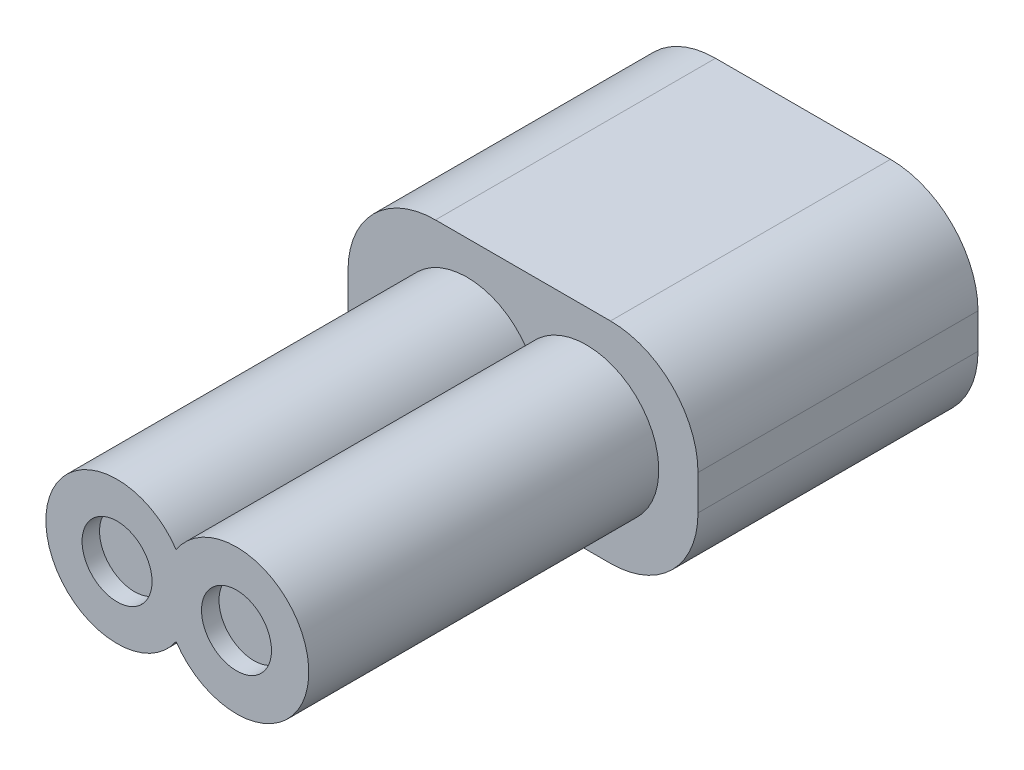
from build123d import *

# Parameters (mm, degrees)
EXTRUDE_1_DEPTH     = 16
EXTRUDE_3_DEPTH     = 20
SKETCH_4_R          = 2
CUT_EXTRUDE_1_DEPTH = 1


with BuildPart() as part:
    # ｽｹｯﾁ1 → ﾎﾞｽ - 押し出し1 (new body)
    with BuildSketch(Plane.XY):
        with BuildLine():
            Line((5, 0), (15, 0))
            ThreePointArc((15, 0), (18.535533906, 1.464466094), (20, 5))
            Line((20, 5), (20, 7))
            ThreePointArc((20, 7), (18.535533906, 10.535533906), (15, 12))
            Line((15, 12), (5, 12))
            ThreePointArc((5, 12), (1.464466094, 10.535533906), (0, 7))
            Line((0, 7), (0, 5))
            ThreePointArc((0, 5), (1.464466094, 1.464466094), (5, 0))
        make_face()
    extrude(amount=EXTRUDE_1_DEPTH)

    # ｽｹｯﾁ3 → ﾎﾞｽ - 押し出し3 (add)
    with BuildSketch(Plane.XY.offset(16)):
        with BuildLine():
            ThreePointArc((10.178530878, 3.727869439), (17.760027495, 6), (10.178530878, 8.272130561))
            ThreePointArc((10.178530878, 8.272130561), (2.735636676, 6), (10.178530878, 3.727869439))
        make_face()
    extrude(amount=EXTRUDE_3_DEPTH)

    # ｽｹｯﾁ4 → ｶｯﾄ - 押し出し1 (cut)
    with BuildSketch(Plane.XY.offset(36)):
        with Locations((6.803896263, 6)):
            Circle(SKETCH_4_R)
        with Locations((13.628807012, 6)):
            Circle(SKETCH_4_R)
    extrude(amount=-CUT_EXTRUDE_1_DEPTH, mode=Mode.SUBTRACT)


solid = part.part
